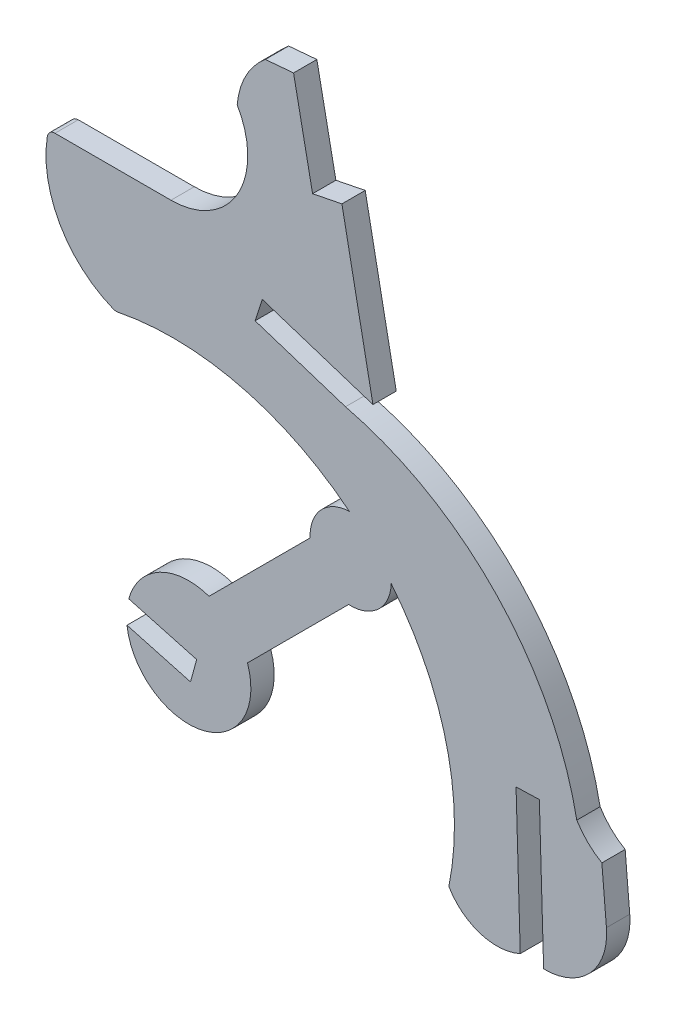
from build123d import *

# Parameters (mm, degrees)
BASE_EXTRUDE_DEPTH = 3


with BuildPart() as part:
    # Sketch1 → Base-Extrude (new body)
    with BuildSketch(Plane.XY):
        with BuildLine():
            Line((293.989820862, 734.197583092), (308.230093844, 729.586709902))
            Line((308.230093844, 729.586709902), (304.237578804, 749.960041406))
            Line((304.237578804, 749.960041406), (300.46187699, 749.205127022))
            Line((300.46187699, 749.205127022), (298.014696403, 761.444692703))
            Line((298.014696403, 761.444692703), (294.380010045, 761.126528526))
            ThreePointArc((294.380010045, 761.126528526), (291.873265467, 758.05762637), (290.76086587, 754.254404584))
            ThreePointArc((290.76086587, 754.254404584), (290.815065416, 744.34095117), (282.238682163, 739.368512483))
            Line((282.238682163, 739.368512483), (267.309755895, 739.368512483))
            ThreePointArc((267.309755895, 739.368512483), (266.660852695, 739.129383455), (266.322292677, 738.526361756))
            ThreePointArc((266.322292677, 738.526361756), (267.945922187, 729.535060668), (274.828113717, 723.525476008))
            ThreePointArc((274.828113717, 723.525476008), (275.107735881, 723.458131465), (275.394960471, 723.473160687))
            ThreePointArc((275.394960471, 723.473160687), (291.10707298, 723.128304911), (305.196249522, 716.165223024))
            ThreePointArc((305.196249522, 716.165223024), (301.525955586, 714.485747009), (300.152427977, 710.690339367))
            Line((300.152427977, 710.690339367), (287.135003329, 697.672914719))
            ThreePointArc((287.135003329, 697.672914719), (280.788235339, 697.185935894), (276.80604128, 692.2199775))
            Line((276.80604128, 692.2199775), (285.544339655, 689.832249216))
            Line((285.544339655, 689.832249216), (284.7535812, 686.938339057))
            Line((284.7535812, 686.938339057), (276.578441435, 689.172182037))
            ThreePointArc((276.578441435, 689.172182037), (286.308923255, 682.31315648), (292.084750798, 692.72316725))
            Line((292.084750798, 692.72316725), (305.102175446, 705.740591898))
            ThreePointArc((305.102175446, 705.740591898), (308.909028424, 707.124695347), (310.57796115, 710.815567264))
            ThreePointArc((310.57796115, 710.815567264), (317.662772954, 696.617074851), (318.003459515, 680.752785464))
            ThreePointArc((318.003459515, 680.752785464), (322.040475508, 677.537424223), (327.190781226, 677.869684733))
            Line((327.190781226, 677.869684733), (326.648810255, 696.184005937))
            Line((326.648810255, 696.184005937), (329.647496764, 696.272745292))
            Line((329.647496764, 696.272745292), (330.19785257, 677.675083141))
            ThreePointArc((330.19785257, 677.675083141), (336.159788883, 680.193967384), (338.280950791, 686.308714689))
            Line((338.280950791, 686.308714689), (337.692715429, 693.239584422))
            ThreePointArc((337.692715429, 693.239584422), (335.883457798, 694.612751583), (334.465786033, 696.387352382))
            ThreePointArc((334.465786033, 696.387352382), (324.143791375, 716.336225522), (304.697858302, 727.577079591))
            Line((304.697858302, 727.577079591), (293.065685578, 731.343473215))
            Line((293.065685578, 731.343473215), (293.989820862, 734.197583092))
        make_face()
    extrude(amount=BASE_EXTRUDE_DEPTH)


solid = part.part
